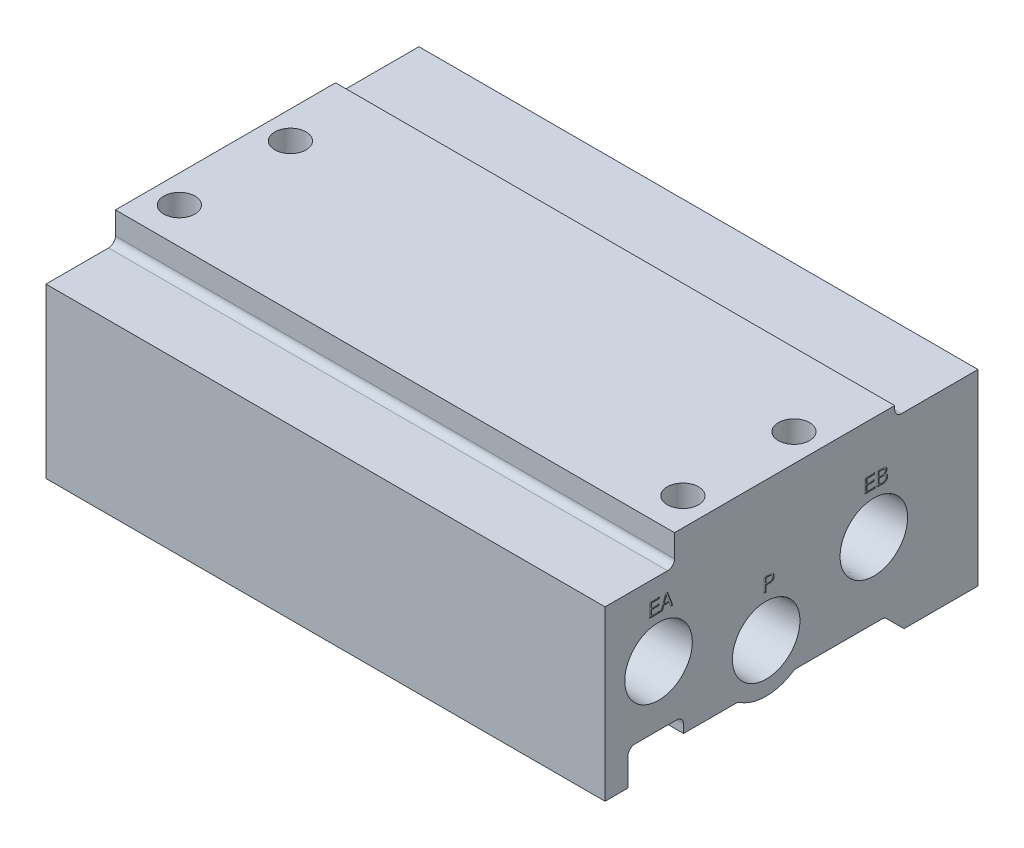
from build123d import *

# Parameters (mm, degrees)
ALUM_EXT_SKETCH_W          = 53.7
ALUM_EXT_SKETCH_H          = 28.5
ALUM_EXT_DEPTH             = 80.5
MGT_HOLES_SKETCH_R         = 2.25
MGT_HOLES_DEPTH            = 90.517721709
TOP_PROFILE_41_SKETCH_W    = 10
TOP_PROFILE_41_SKETCH_H    = 4.25
TOP_PROFILE_41_SKETCH_W_2  = 12
TOP_PROFILE_41_SKETCH_H_2  = 1.5
TOP_PROFILE_41_DEPTH       = 90.517721709
BOTTOM_PROFILE_41_DEPTH    = 90.517721709
ROUNDS_41_R                = 1
PORTS_AT_2_COUNT           = 2
PORTS_AT_2_PITCH           = 16.317475295
PORTS_AT_3_COUNT           = 2
PORTS_AT_3_PITCH           = 16.317475295
PORTS_MIRROR_AT_2_COUNT    = 2
PORTS_MIRROR_AT_2_PITCH    = 16.317475295
PORTS_MIRROR_AT_3_COUNT    = 2
PORTS_MIRROR_AT_3_PITCH    = 31
F_41_42_PORT_LABELS1_DEPTH = 0.1
F_41_42_PORT_LABELS2_DEPTH = 0.1
F_41_42_A_B_LABELS_DEPTH   = 0.1


with BuildPart() as part:
    # Alum Ext Sketch → Alum Ext (new body)
    with BuildSketch(Plane(origin=(0, 0, 0), x_dir=(0, 0, -1), z_dir=(1, 0, 0))):
        with Locations((0, -14.25)):
            Rectangle(ALUM_EXT_SKETCH_W, ALUM_EXT_SKETCH_H)
    extrude(amount=-ALUM_EXT_DEPTH)

    # MGT_Holes Sketch → MGT_Holes (cut, through all)
    with BuildSketch(Plane(origin=(0, 0, 0), x_dir=(1, 0, 0), z_dir=(0, 1, 0))):
        with Locations(Location((-76.5, 4.35, 0), (0, 0, 270))):
            Circle(MGT_HOLES_SKETCH_R)
        with Locations(Location((-76.5, -11.65, 0), (0, 0, 90))):
            Circle(MGT_HOLES_SKETCH_R)
        with Locations(Location((-4, 4.35, 0), (0, 0, 270))):
            Circle(MGT_HOLES_SKETCH_R)
        with Locations(Location((-4, -11.65, 0), (0, 0, 270))):
            Circle(MGT_HOLES_SKETCH_R)
    extrude(amount=-MGT_HOLES_DEPTH, mode=Mode.SUBTRACT)

    # Top_Profile_41 Sketch → Top_Profile_41 (cut, through all)
    with BuildSketch(Plane(origin=(0, 0, 0), x_dir=(0, 0, -1), z_dir=(1, 0, 0))):
        with Locations((-21.85, -2.125)):
            Rectangle(TOP_PROFILE_41_SKETCH_W, TOP_PROFILE_41_SKETCH_H)
        with Locations((20.85, -0.75)):
            Rectangle(TOP_PROFILE_41_SKETCH_W_2, TOP_PROFILE_41_SKETCH_H_2)
    extrude(amount=-TOP_PROFILE_41_DEPTH, mode=Mode.SUBTRACT)

    # Bottom_Profile_41 Sketch → Bottom_Profile_41 (cut, through all)
    with BuildSketch(Plane(origin=(0, 0, 0), x_dir=(0, 0, -1), z_dir=(1, 0, 0))):
        with BuildLine():
            Line((16.2, -28.5), (13.4, -25.7))
            Line((13.4, -25.7), (0.413249931, -25.7))
            ThreePointArc((0.413249931, -25.7), (-3.65, -27), (-7.713249931, -25.7))
            Line((-7.713249931, -25.7), (-15.55, -25.7))
            Line((-15.55, -25.7), (-15.55, -23.5))
            Line((-15.55, -23.5), (-23.55, -23.5))
            Line((-23.55, -23.5), (-23.55, -28.5))
            Line((-23.55, -28.5), (16.2, -28.5))
        make_face()
    extrude(amount=-BOTTOM_PROFILE_41_DEPTH, mode=Mode.SUBTRACT)

    # Rounds_41
    rounds_41_edges = [part.edges().sort_by_distance(p)[0] for p in [
        (-40.25, -4.25, 16.85),
        (-40.25, -1.5, -14.85),
        (-40.25, -25.7, -0.413249931),
        (-40.25, -23.5, 23.55),
        (-40.25, -23.5, 15.55),
        (-40.25, -25.7, 7.713249931),
        (-40.25, -25.7, -13.4),
    ]]
    fillet(rounds_41_edges, radius=ROUNDS_41_R)

    # Ports Profile Sketch → Ports (revolve, cut)
    with BuildSketch(Plane(origin=(0, -20, 3.65), x_dir=(0, 0, -1), z_dir=(0, 1, 0))):
        Polygon((0, 0), (0, 22.45), (3.95, 18.5), (3.95, 7.4), (4.632997004, 7.4), (4.864, 0), align=None)
    ports = revolve(axis=Axis((6.35, -20, 3.65), (-1, 0, 0)), mode=Mode.SUBTRACT)

    # Ports at 2: Ports ×2
    with Locations(*[Vector(0, 0.31254835125081226, -0.9499018518407041) * (i * PORTS_AT_2_PITCH) for i in range(1, PORTS_AT_2_COUNT)]):
        add(ports, mode=Mode.SUBTRACT)

    # Ports at 3: Ports ×2
    with Locations(*[Vector(0, 0.31254835125081226, 0.9499018518407041) * (i * PORTS_AT_3_PITCH) for i in range(1, PORTS_AT_3_COUNT)]):
        add(ports, mode=Mode.SUBTRACT)

    # Ports Mirror Profile Sketch → Ports Mirror (revolve, cut)
    with BuildSketch(Plane(origin=(-80.5, -14.9, -11.85), x_dir=(0, 0, 1), z_dir=(0, 1, 0))):
        Polygon((0, 0), (0, 15.885), (3.95, 11.935), (3.95, 7.4), (4.632997004, 7.4), (4.864, 0), align=None)
    ports_mirror = revolve(axis=Axis((-86.85, -14.9, -11.85), (1, 0, 0)), mode=Mode.SUBTRACT)

    # Ports Mirror at 2: Ports Mirror ×2
    with Locations(*[Vector(0, -0.31254835125081226, 0.9499018518407041) * (i * PORTS_MIRROR_AT_2_PITCH) for i in range(1, PORTS_MIRROR_AT_2_COUNT)]):
        add(ports_mirror, mode=Mode.SUBTRACT)

    # Ports Mirror at 3: Ports Mirror ×2
    with Locations(*[(0, 0, i * PORTS_MIRROR_AT_3_PITCH) for i in range(1, PORTS_MIRROR_AT_3_COUNT)]):
        add(ports_mirror, mode=Mode.SUBTRACT)

    # 41,42 Port Labels1 Sketch → 41,42 Port Labels1 (cut)
    # profile 1 of 5: a face of its own
    with BuildSketch(Plane.ZY.offset(80.5)):
        Polygon((-13.144871795, -8.9), (-13.144871795, -6.9), (-11.731410256, -6.9), (-11.731410256, -7.130769231), (-12.862820513, -7.130769231), (-12.862820513, -7.746153846), (-11.817948718, -7.746153846), (-11.817948718, -7.976923077), (-12.862820513, -7.976923077), (-12.862820513, -8.669230769), (-11.708974359, -8.669230769), (-11.708974359, -8.9), align=None)
    # profile 2 of 5: a face of its own
    with BuildSketch(Plane.ZY.offset(80.5)):
        with BuildLine():
            Line((-11.375641026, -8.9), (-11.375641026, -6.9))
            Line((-11.375641026, -6.9), (-10.582371795, -6.9))
            add(Edge.make_bspline(
                [(-10.582371795, -6.9), (-10.557520601, -6.900391088), (-10.509221677, -6.901151178), (-10.439257463, -6.906808568), (-10.373884128, -6.915794729), (-10.313491954, -6.928977632), (-10.25772712, -6.945607443), (-10.206981233, -6.966644139), (-10.160714162, -6.990826937), (-10.119486132, -7.019131964), (-10.082912178, -7.050918934), (-10.051607199, -7.087006382), (-10.024425363, -7.126312863), (-10.002795087, -7.169699096), (-9.985826511, -7.216613207), (-9.974014126, -7.267309873), (-9.966656438, -7.321659157), (-9.965816477, -7.359110147), (-9.965384615, -7.378365385)],
                knots=[0, 0, 0, 0, 1.338531614, 2.601470082, 3.778553788, 4.890456792, 5.928162005, 6.908738963, 7.84520586, 8.735147048, 9.596633689, 10.447968487, 11.301973765, 12.164180963, 13.051676454, 13.983434255, 14.963192844, 16, 16, 16, 16], degree=3))
            add(Edge.make_bspline(
                [(-9.965384615, -7.378365385), (-9.966331591, -7.402996395), (-9.968168925, -7.450785796), (-9.981718133, -7.519887959), (-10.005663085, -7.582918484), (-10.038410282, -7.640323126), (-10.080645807, -7.691469707), (-10.132507487, -7.735784439), (-10.193110711, -7.77443215), (-10.238424067, -7.793555438), (-10.261858974, -7.803445513)],
                knots=[0, 0, 0, 0, 1.064089938, 2.064560856, 3.027045975, 3.965441717, 4.908263127, 5.877849772, 6.902478258, 8, 8, 8, 8], degree=3))
            add(Edge.make_bspline(
                [(-10.261858974, -7.803445513), (-10.246569522, -7.806518626), (-10.216485798, -7.812565323), (-10.17316555, -7.826052918), (-10.132251748, -7.841956303), (-10.093880076, -7.860736947), (-10.058519403, -7.883036867), (-10.02554128, -7.907811801), (-9.995201163, -7.935720854), (-9.967752142, -7.966578157), (-9.94267115, -7.999705375), (-9.921668464, -8.035541546), (-9.903328698, -8.073092565), (-9.888526343, -8.112963113), (-9.876994446, -8.155075497), (-9.868507088, -8.199259529), (-9.863726514, -8.245513022), (-9.863126284, -8.276992465), (-9.862820513, -8.293028846)],
                knots=[0, 0, 0, 0, 1.079472139, 2.123983387, 3.137357801, 4.117691995, 5.07752268, 6.028353704, 6.970961659, 7.927265266, 8.885490285, 9.843581377, 10.799169054, 11.776706782, 12.784239396, 13.820032524, 14.889472473, 16, 16, 16, 16], degree=3))
            add(Edge.make_bspline(
                [(-9.862820513, -8.293028846), (-9.863272496, -8.315767522), (-9.864153514, -8.360090374), (-9.873541022, -8.424660596), (-9.887061044, -8.485768657), (-9.907353971, -8.543283868), (-9.933566292, -8.597000116), (-9.964872333, -8.647657469), (-10.002489133, -8.694254066), (-10.045355165, -8.737068494), (-10.093055612, -8.775646479), (-10.145401463, -8.808971319), (-10.201906819, -8.836986969), (-10.262136906, -8.860475813), (-10.326816833, -8.877901069), (-10.395416655, -8.890532564), (-10.468116052, -8.898929064), (-10.517977934, -8.899637332), (-10.543509615, -8.9)],
                knots=[0, 0, 0, 0, 1.058427598, 2.063116183, 3.033417234, 3.969927738, 4.896405358, 5.812972495, 6.737861532, 7.679194237, 8.630321786, 9.589794139, 10.563499171, 11.563941868, 12.596215416, 13.678433312, 14.811246201, 16, 16, 16, 16], degree=3))
            Line((-10.543509615, -8.9), (-11.375641026, -8.9))
        make_face()
        with BuildLine():
            Line((-11.093589744, -7.720512821), (-10.638060897, -7.720512821))
            add(Edge.make_bspline(
                [(-10.638060897, -7.720512821), (-10.62189856, -7.72024581), (-10.59060934, -7.719728896), (-10.545208349, -7.716795414), (-10.503095771, -7.710636868), (-10.464283505, -7.702711026), (-10.428663129, -7.693061693), (-10.39684222, -7.679824467), (-10.367793522, -7.665385266), (-10.342235553, -7.64779035), (-10.319629027, -7.628173795), (-10.300015633, -7.605914124), (-10.284162537, -7.580643527), (-10.270210543, -7.55333256), (-10.259923231, -7.523089629), (-10.252860224, -7.490409561), (-10.248348588, -7.45527911), (-10.247747178, -7.430997327), (-10.247435897, -7.418429487)],
                knots=[0, 0, 0, 0, 1.368886017, 2.65007316, 3.849640785, 4.969751217, 6.004381673, 6.968357812, 7.883879336, 8.746530739, 9.588092002, 10.41369514, 11.248159001, 12.107988605, 13.005734059, 13.944160956, 14.935932503, 16, 16, 16, 16], degree=3))
            add(Edge.make_bspline(
                [(-10.247435897, -7.418429487), (-10.24779526, -7.406534873), (-10.248487838, -7.383611119), (-10.252344592, -7.350275069), (-10.259615487, -7.319417291), (-10.2694704, -7.29082689), (-10.28256798, -7.264808482), (-10.298163447, -7.241021057), (-10.316774453, -7.219617856), (-10.338193209, -7.200634591), (-10.362634513, -7.184106045), (-10.389977449, -7.169577213), (-10.420615726, -7.157824898), (-10.454032304, -7.147613488), (-10.490564803, -7.140314754), (-10.529999659, -7.134572338), (-10.572575304, -7.131523238), (-10.60199904, -7.131026383), (-10.617227564, -7.130769231)],
                knots=[0, 0, 0, 0, 1.064043854, 2.05066597, 2.995108535, 3.894129092, 4.74873584, 5.593437176, 6.431611697, 7.277662936, 8.145602371, 9.064553025, 10.040417484, 11.075719197, 12.186014413, 13.368359838, 14.637970495, 16, 16, 16, 16], degree=3))
            Line((-10.617227564, -7.130769231), (-11.093589744, -7.130769231))
            Line((-11.093589744, -7.130769231), (-11.093589744, -7.720512821))
        make_face(mode=Mode.SUBTRACT)
        with BuildLine():
            Line((-11.093589744, -8.669230769), (-10.566746795, -8.669230769))
            add(Edge.make_bspline(
                [(-10.566746795, -8.669230769), (-10.549908372, -8.668922161), (-10.517373227, -8.668325869), (-10.470137599, -8.663774034), (-10.425994956, -8.656854934), (-10.385013028, -8.64634983), (-10.346971081, -8.633180858), (-10.312127837, -8.616877954), (-10.280547117, -8.597345386), (-10.251784041, -8.575352814), (-10.226609275, -8.550046268), (-10.204679995, -8.522071895), (-10.186188284, -8.49137213), (-10.170917321, -8.458069746), (-10.159316799, -8.421991925), (-10.151012013, -8.383343954), (-10.145625468, -8.342058175), (-10.145127121, -8.313612472), (-10.144871795, -8.299038462)],
                knots=[0, 0, 0, 0, 1.261340787, 2.437158505, 3.552412744, 4.605618057, 5.602418951, 6.564726798, 7.481099983, 8.379712099, 9.271165627, 10.147841252, 11.036708081, 11.950072001, 12.886651798, 13.869902527, 14.90865543, 16, 16, 16, 16], degree=3))
            add(Edge.make_bspline(
                [(-10.144871795, -8.299038462), (-10.145117446, -8.284595974), (-10.145594563, -8.256544995), (-10.151054338, -8.215943132), (-10.159140342, -8.17810658), (-10.171288059, -8.143473319), (-10.18652651, -8.111724261), (-10.205588286, -8.083183638), (-10.227647172, -8.057184402), (-10.253710324, -8.034583368), (-10.28331899, -8.01494812), (-10.31638283, -7.997503895), (-10.353598, -7.98333953), (-10.394496601, -7.971081379), (-10.439692519, -7.962804431), (-10.488439021, -7.955798704), (-10.541174333, -7.951838231), (-10.577557944, -7.951471772), (-10.596394231, -7.951282051)],
                knots=[0, 0, 0, 0, 1.058252033, 2.055394168, 2.998523969, 3.890395008, 4.739981298, 5.573732922, 6.40003374, 7.23274972, 8.093659094, 9.000297479, 9.967667442, 11.00874663, 12.12639854, 13.332554366, 14.619027337, 16, 16, 16, 16], degree=3))
            Line((-10.596394231, -7.951282051), (-11.093589744, -7.951282051))
            Line((-11.093589744, -7.951282051), (-11.093589744, -8.669230769))
        make_face(mode=Mode.SUBTRACT)
    # profile 3 of 5: a face of its own
    with BuildSketch(Plane.ZY.offset(80.5)):
        with BuildLine():
            Line((3.355128205, -14), (3.355128205, -12))
            Line((3.355128205, -12), (4.095913462, -12))
            add(Edge.make_bspline(
                [(4.095913462, -12), (4.12409362, -12.000249378), (4.177002091, -12.000717587), (4.250934098, -12.003608091), (4.314154858, -12.009200397), (4.368073681, -12.016451865), (4.415166702, -12.02754219), (4.458606554, -12.040013914), (4.499344903, -12.056098279), (4.524832794, -12.069234093), (4.537419872, -12.075721154)],
                knots=[0, 0, 0, 0, 1.493455121, 2.803973871, 3.919514338, 4.856337602, 5.683863995, 6.481055044, 7.249876038, 8, 8, 8, 8], degree=3))
            add(Edge.make_bspline(
                [(4.537419872, -12.075721154), (4.557109161, -12.087505308), (4.596238242, -12.110924292), (4.646867088, -12.157428597), (4.691435381, -12.210646113), (4.726929673, -12.2725773), (4.756116688, -12.340350372), (4.776198097, -12.414407034), (4.789029685, -12.493809121), (4.790347685, -12.548692188), (4.791025641, -12.576923077)],
                knots=[0, 0, 0, 0, 0.930560885, 1.849329941, 2.778623248, 3.742228717, 4.739438803, 5.770715934, 6.853295292, 8, 8, 8, 8], degree=3))
            add(Edge.make_bspline(
                [(4.791025641, -12.576923077), (4.790347059, -12.603953612), (4.78902587, -12.65658169), (4.776100386, -12.733053307), (4.755916476, -12.804708226), (4.727367087, -12.871331941), (4.690898401, -12.932063622), (4.64652939, -12.986531524), (4.594678687, -13.034755885), (4.555051994, -13.060899771), (4.535016026, -13.07411859)],
                knots=[0, 0, 0, 0, 1.106237948, 2.15382993, 3.166616047, 4.14912887, 5.113446575, 6.058253874, 7.018218259, 8, 8, 8, 8], degree=3))
            add(Edge.make_bspline(
                [(4.535016026, -13.07411859), (4.522597077, -13.081071894), (4.497311506, -13.095229151), (4.456117103, -13.111618603), (4.412179284, -13.125952788), (4.372704814, -13.134789239), (4.337996409, -13.140616309), (4.307779075, -13.144194947), (4.273668896, -13.146691653), (4.235640761, -13.149761537), (4.193551564, -13.151643471), (4.147467197, -13.152726574), (4.097518693, -13.153554018), (4.06292769, -13.153746548), (4.045032051, -13.153846154)],
                knots=[0, 0, 0, 0, 1.018466528, 2.073646265, 3.168741587, 4.32666575, 4.966710573, 5.68928523, 6.505122404, 7.416327688, 8.421864515, 9.522294478, 10.718160255, 12, 12, 12, 12], degree=3))
            Line((4.045032051, -13.153846154), (3.637179487, -13.153846154))
            Line((3.637179487, -13.153846154), (3.637179487, -14))
            Line((3.637179487, -14), (3.355128205, -14))
        make_face()
        with BuildLine():
            Line((3.637179487, -12.923076923), (4.087900641, -12.923076923))
            add(Edge.make_bspline(
                [(4.087900641, -12.923076923), (4.106734424, -12.922848085), (4.142970313, -12.922407806), (4.195182234, -12.919020543), (4.2428652, -12.912380011), (4.286306282, -12.90452837), (4.324991337, -12.892914993), (4.359724875, -12.880257808), (4.389709515, -12.863882812), (4.415997913, -12.84536947), (4.43829063, -12.823331396), (4.457379289, -12.798065143), (4.473409826, -12.769311124), (4.486624477, -12.737183964), (4.496532941, -12.70151272), (4.503634352, -12.662491291), (4.508057153, -12.619891899), (4.508660905, -12.590288992), (4.508974359, -12.574919872)],
                knots=[0, 0, 0, 0, 1.418142734, 2.728483292, 3.935852239, 5.042182902, 6.047730313, 6.973980857, 7.819836916, 8.612371598, 9.387426252, 10.169752478, 10.989196503, 11.859387264, 12.779284547, 13.771317079, 14.842921177, 16, 16, 16, 16], degree=3))
            add(Edge.make_bspline(
                [(4.508974359, -12.574919872), (4.508621001, -12.560087188), (4.507941592, -12.531568007), (4.504041052, -12.490281163), (4.497103925, -12.452223938), (4.486320171, -12.417522781), (4.473955018, -12.385611284), (4.457636989, -12.357322195), (4.43872536, -12.332221086), (4.416721841, -12.31008833), (4.391039013, -12.291246478), (4.361972539, -12.274585285), (4.328843401, -12.261233914), (4.292121529, -12.249962633), (4.251491521, -12.241304691), (4.207065619, -12.234912843), (4.15873708, -12.23141909), (4.125299202, -12.230991373), (4.107932692, -12.230769231)],
                knots=[0, 0, 0, 0, 1.160442503, 2.231212519, 3.241398704, 4.180061104, 5.070566702, 5.91288362, 6.725721963, 7.523583634, 8.344772017, 9.210415603, 10.137847341, 11.13257169, 12.212527806, 13.384203378, 14.64144318, 16, 16, 16, 16], degree=3))
            Line((4.107932692, -12.230769231), (3.637179487, -12.230769231))
            Line((3.637179487, -12.230769231), (3.637179487, -12.923076923))
        make_face(mode=Mode.SUBTRACT)
    # profile 4 of 5: a face of its own
    with BuildSketch(Plane.ZY.offset(80.5)):
        Polygon((17.855128205, -8.9), (17.855128205, -6.9), (19.268589744, -6.9), (19.268589744, -7.130769231), (18.137179487, -7.130769231), (18.137179487, -7.746153846), (19.182051282, -7.746153846), (19.182051282, -7.976923077), (18.137179487, -7.976923077), (18.137179487, -8.669230769), (19.291025641, -8.669230769), (19.291025641, -8.9), align=None)
    # profile 5 of 5: a face of its own
    with BuildSketch(Plane.ZY.offset(80.5)):
        Polygon((19.419230769, -8.9), (20.149198718, -6.9), (20.447676282, -6.9), (21.188461538, -8.9), (20.895592949, -8.9), (20.68525641, -8.31025641), (19.902403846, -8.31025641), (19.690464744, -8.9), align=None)
        Polygon((19.986137821, -8.079487179), (20.605528846, -8.079487179), (20.297836538, -7.188862179), align=None, mode=Mode.SUBTRACT)
    extrude(amount=-F_41_42_PORT_LABELS1_DEPTH, mode=Mode.SUBTRACT)

    # 41,42 Port Labels2 Sketch → 41,42 Port Labels2 (cut)
    # profile 1 of 5: a face of its own
    with BuildSketch(Plane(origin=(0, 0, 0), x_dir=(0, 0, -1), z_dir=(1, 0, 0))):
        Polygon((-20.444871795, -8.9), (-20.444871795, -6.9), (-19.031410256, -6.9), (-19.031410256, -7.130769231), (-20.162820513, -7.130769231), (-20.162820513, -7.746153846), (-19.117948718, -7.746153846), (-19.117948718, -7.976923077), (-20.162820513, -7.976923077), (-20.162820513, -8.669230769), (-19.008974359, -8.669230769), (-19.008974359, -8.9), align=None)
    # profile 2 of 5: a face of its own
    with BuildSketch(Plane(origin=(0, 0, 0), x_dir=(0, 0, -1), z_dir=(1, 0, 0))):
        Polygon((-18.880769231, -8.9), (-18.150801282, -6.9), (-17.852323718, -6.9), (-17.111538462, -8.9), (-17.404407051, -8.9), (-17.61474359, -8.31025641), (-18.397596154, -8.31025641), (-18.609535256, -8.9), align=None)
        Polygon((-18.313862179, -8.079487179), (-17.694471154, -8.079487179), (-18.002163462, -7.188862179), align=None, mode=Mode.SUBTRACT)
    # profile 3 of 5: a face of its own
    with BuildSketch(Plane(origin=(0, 0, 0), x_dir=(0, 0, -1), z_dir=(1, 0, 0))):
        with BuildLine():
            Line((-3.944871795, -14), (-3.944871795, -12))
            Line((-3.944871795, -12), (-3.204086538, -12))
            add(Edge.make_bspline(
                [(-3.204086538, -12), (-3.17590638, -12.000249378), (-3.122997909, -12.000717587), (-3.049065902, -12.003608091), (-2.985845142, -12.009200397), (-2.931926319, -12.016451865), (-2.884833298, -12.02754219), (-2.841393446, -12.040013914), (-2.800655097, -12.056098279), (-2.775167206, -12.069234093), (-2.762580128, -12.075721154)],
                knots=[0, 0, 0, 0, 1.493455121, 2.803973871, 3.919514338, 4.856337602, 5.683863995, 6.481055044, 7.249876038, 8, 8, 8, 8], degree=3))
            add(Edge.make_bspline(
                [(-2.762580128, -12.075721154), (-2.742890839, -12.087505308), (-2.703761758, -12.110924292), (-2.653132912, -12.157428597), (-2.608564619, -12.210646113), (-2.573070327, -12.2725773), (-2.543883312, -12.340350372), (-2.523801903, -12.414407034), (-2.510970315, -12.493809121), (-2.509652315, -12.548692188), (-2.508974359, -12.576923077)],
                knots=[0, 0, 0, 0, 0.930560885, 1.849329941, 2.778623248, 3.742228717, 4.739438803, 5.770715934, 6.853295292, 8, 8, 8, 8], degree=3))
            add(Edge.make_bspline(
                [(-2.508974359, -12.576923077), (-2.509652941, -12.603953612), (-2.51097413, -12.65658169), (-2.523899614, -12.733053307), (-2.544083524, -12.804708226), (-2.572632913, -12.871331941), (-2.609101599, -12.932063622), (-2.65347061, -12.986531524), (-2.705321313, -13.034755885), (-2.744948006, -13.060899771), (-2.764983974, -13.07411859)],
                knots=[0, 0, 0, 0, 1.106237948, 2.15382993, 3.166616047, 4.14912887, 5.113446575, 6.058253874, 7.018218259, 8, 8, 8, 8], degree=3))
            add(Edge.make_bspline(
                [(-2.764983974, -13.07411859), (-2.777402923, -13.081071894), (-2.802688494, -13.095229151), (-2.843882897, -13.111618603), (-2.887820716, -13.125952788), (-2.927295186, -13.134789239), (-2.962003591, -13.140616309), (-2.992220925, -13.144194947), (-3.026331104, -13.146691653), (-3.064359239, -13.149761537), (-3.106448436, -13.151643471), (-3.152532803, -13.152726574), (-3.202481307, -13.153554018), (-3.23707231, -13.153746548), (-3.254967949, -13.153846154)],
                knots=[0, 0, 0, 0, 1.018466528, 2.073646265, 3.168741587, 4.32666575, 4.966710573, 5.68928523, 6.505122404, 7.416327688, 8.421864515, 9.522294478, 10.718160255, 12, 12, 12, 12], degree=3))
            Line((-3.254967949, -13.153846154), (-3.662820513, -13.153846154))
            Line((-3.662820513, -13.153846154), (-3.662820513, -14))
            Line((-3.662820513, -14), (-3.944871795, -14))
        make_face()
        with BuildLine():
            Line((-3.662820513, -12.923076923), (-3.212099359, -12.923076923))
            add(Edge.make_bspline(
                [(-3.212099359, -12.923076923), (-3.193265576, -12.922848085), (-3.157029687, -12.922407806), (-3.104817766, -12.919020543), (-3.0571348, -12.912380011), (-3.013693718, -12.90452837), (-2.975008663, -12.892914993), (-2.940275125, -12.880257808), (-2.910290485, -12.863882812), (-2.884002087, -12.84536947), (-2.86170937, -12.823331396), (-2.842620711, -12.798065143), (-2.826590174, -12.769311124), (-2.813375523, -12.737183964), (-2.803467059, -12.70151272), (-2.796365648, -12.662491291), (-2.791942847, -12.619891899), (-2.791339095, -12.590288992), (-2.791025641, -12.574919872)],
                knots=[0, 0, 0, 0, 1.418142734, 2.728483292, 3.935852239, 5.042182902, 6.047730313, 6.973980857, 7.819836916, 8.612371598, 9.387426252, 10.169752478, 10.989196503, 11.859387264, 12.779284547, 13.771317079, 14.842921177, 16, 16, 16, 16], degree=3))
            add(Edge.make_bspline(
                [(-2.791025641, -12.574919872), (-2.791378999, -12.560087188), (-2.792058408, -12.531568007), (-2.795958948, -12.490281163), (-2.802896075, -12.452223938), (-2.813679829, -12.417522781), (-2.826044982, -12.385611284), (-2.842363011, -12.357322195), (-2.86127464, -12.332221086), (-2.883278159, -12.31008833), (-2.908960987, -12.291246478), (-2.938027461, -12.274585285), (-2.971156599, -12.261233914), (-3.007878471, -12.249962633), (-3.048508479, -12.241304691), (-3.092934381, -12.234912843), (-3.14126292, -12.23141909), (-3.174700798, -12.230991373), (-3.192067308, -12.230769231)],
                knots=[0, 0, 0, 0, 1.160442503, 2.231212519, 3.241398704, 4.180061104, 5.070566702, 5.91288362, 6.725721963, 7.523583634, 8.344772017, 9.210415603, 10.137847341, 11.13257169, 12.212527806, 13.384203378, 14.64144318, 16, 16, 16, 16], degree=3))
            Line((-3.192067308, -12.230769231), (-3.662820513, -12.230769231))
            Line((-3.662820513, -12.230769231), (-3.662820513, -12.923076923))
        make_face(mode=Mode.SUBTRACT)
    # profile 4 of 5: a face of its own
    with BuildSketch(Plane(origin=(0, 0, 0), x_dir=(0, 0, -1), z_dir=(1, 0, 0))):
        Polygon((10.555128205, -8.9), (10.555128205, -6.9), (11.968589744, -6.9), (11.968589744, -7.130769231), (10.837179487, -7.130769231), (10.837179487, -7.746153846), (11.882051282, -7.746153846), (11.882051282, -7.976923077), (10.837179487, -7.976923077), (10.837179487, -8.669230769), (11.991025641, -8.669230769), (11.991025641, -8.9), align=None)
    # profile 5 of 5: a face of its own
    with BuildSketch(Plane(origin=(0, 0, 0), x_dir=(0, 0, -1), z_dir=(1, 0, 0))):
        with BuildLine():
            Line((12.324358974, -8.9), (12.324358974, -6.9))
            Line((12.324358974, -6.9), (13.117628205, -6.9))
            add(Edge.make_bspline(
                [(13.117628205, -6.9), (13.142479399, -6.900391088), (13.190778323, -6.901151178), (13.260742537, -6.906808568), (13.326115872, -6.915794729), (13.386508046, -6.928977632), (13.44227288, -6.945607443), (13.493018767, -6.966644139), (13.539285838, -6.990826937), (13.580513868, -7.019131964), (13.617087822, -7.050918934), (13.648392801, -7.087006382), (13.675574637, -7.126312863), (13.697204913, -7.169699096), (13.714173489, -7.216613207), (13.725985874, -7.267309873), (13.733343562, -7.321659157), (13.734183523, -7.359110147), (13.734615385, -7.378365385)],
                knots=[0, 0, 0, 0, 1.338531614, 2.601470082, 3.778553788, 4.890456792, 5.928162005, 6.908738963, 7.84520586, 8.735147048, 9.596633689, 10.447968487, 11.301973765, 12.164180963, 13.051676454, 13.983434255, 14.963192844, 16, 16, 16, 16], degree=3))
            add(Edge.make_bspline(
                [(13.734615385, -7.378365385), (13.733668409, -7.402996395), (13.731831075, -7.450785796), (13.718281867, -7.519887959), (13.694336915, -7.582918484), (13.661589718, -7.640323126), (13.619354193, -7.691469707), (13.567492513, -7.735784439), (13.506889289, -7.77443215), (13.461575933, -7.793555438), (13.438141026, -7.803445513)],
                knots=[0, 0, 0, 0, 1.064089938, 2.064560856, 3.027045975, 3.965441717, 4.908263127, 5.877849772, 6.902478258, 8, 8, 8, 8], degree=3))
            add(Edge.make_bspline(
                [(13.438141026, -7.803445513), (13.453430478, -7.806518626), (13.483514202, -7.812565323), (13.52683445, -7.826052918), (13.567748252, -7.841956303), (13.606119924, -7.860736947), (13.641480597, -7.883036867), (13.67445872, -7.907811801), (13.704798837, -7.935720854), (13.732247858, -7.966578157), (13.75732885, -7.999705375), (13.778331536, -8.035541546), (13.796671302, -8.073092565), (13.811473657, -8.112963113), (13.823005554, -8.155075497), (13.831492912, -8.199259529), (13.836273486, -8.245513022), (13.836873716, -8.276992465), (13.837179487, -8.293028846)],
                knots=[0, 0, 0, 0, 1.079472139, 2.123983387, 3.137357801, 4.117691995, 5.07752268, 6.028353704, 6.970961659, 7.927265266, 8.885490285, 9.843581377, 10.799169054, 11.776706782, 12.784239396, 13.820032524, 14.889472473, 16, 16, 16, 16], degree=3))
            add(Edge.make_bspline(
                [(13.837179487, -8.293028846), (13.836727504, -8.315767522), (13.835846486, -8.360090374), (13.826458978, -8.424660596), (13.812938956, -8.485768657), (13.792646029, -8.543283868), (13.766433708, -8.597000116), (13.735127667, -8.647657469), (13.697510867, -8.694254066), (13.654644835, -8.737068494), (13.606944388, -8.775646479), (13.554598537, -8.808971319), (13.498093181, -8.836986969), (13.437863094, -8.860475813), (13.373183167, -8.877901069), (13.304583345, -8.890532564), (13.231883948, -8.898929064), (13.182022066, -8.899637332), (13.156490385, -8.9)],
                knots=[0, 0, 0, 0, 1.058427598, 2.063116183, 3.033417234, 3.969927738, 4.896405358, 5.812972495, 6.737861532, 7.679194237, 8.630321786, 9.589794139, 10.563499171, 11.563941868, 12.596215416, 13.678433312, 14.811246201, 16, 16, 16, 16], degree=3))
            Line((13.156490385, -8.9), (12.324358974, -8.9))
        make_face()
        with BuildLine():
            Line((12.606410256, -7.720512821), (13.061939103, -7.720512821))
            add(Edge.make_bspline(
                [(13.061939103, -7.720512821), (13.07810144, -7.72024581), (13.10939066, -7.719728896), (13.154791651, -7.716795414), (13.196904229, -7.710636868), (13.235716495, -7.702711026), (13.271336871, -7.693061693), (13.30315778, -7.679824467), (13.332206478, -7.665385266), (13.357764447, -7.64779035), (13.380370973, -7.628173795), (13.399984367, -7.605914124), (13.415837463, -7.580643527), (13.429789457, -7.55333256), (13.440076769, -7.523089629), (13.447139776, -7.490409561), (13.451651412, -7.45527911), (13.452252822, -7.430997327), (13.452564103, -7.418429487)],
                knots=[0, 0, 0, 0, 1.368886017, 2.65007316, 3.849640785, 4.969751217, 6.004381673, 6.968357812, 7.883879336, 8.746530739, 9.588092002, 10.41369514, 11.248159001, 12.107988605, 13.005734059, 13.944160956, 14.935932503, 16, 16, 16, 16], degree=3))
            add(Edge.make_bspline(
                [(13.452564103, -7.418429487), (13.45220474, -7.406534873), (13.451512162, -7.383611119), (13.447655408, -7.350275069), (13.440384513, -7.319417291), (13.4305296, -7.29082689), (13.41743202, -7.264808482), (13.401836553, -7.241021057), (13.383225547, -7.219617856), (13.361806791, -7.200634591), (13.337365487, -7.184106045), (13.310022551, -7.169577213), (13.279384274, -7.157824898), (13.245967696, -7.147613488), (13.209435197, -7.140314754), (13.170000341, -7.134572338), (13.127424696, -7.131523238), (13.09800096, -7.131026383), (13.082772436, -7.130769231)],
                knots=[0, 0, 0, 0, 1.064043854, 2.05066597, 2.995108535, 3.894129092, 4.74873584, 5.593437176, 6.431611697, 7.277662936, 8.145602371, 9.064553025, 10.040417484, 11.075719197, 12.186014413, 13.368359838, 14.637970495, 16, 16, 16, 16], degree=3))
            Line((13.082772436, -7.130769231), (12.606410256, -7.130769231))
            Line((12.606410256, -7.130769231), (12.606410256, -7.720512821))
        make_face(mode=Mode.SUBTRACT)
        with BuildLine():
            Line((12.606410256, -8.669230769), (13.133253205, -8.669230769))
            add(Edge.make_bspline(
                [(13.133253205, -8.669230769), (13.150091628, -8.668922161), (13.182626773, -8.668325869), (13.229862401, -8.663774034), (13.274005044, -8.656854934), (13.314986972, -8.64634983), (13.353028919, -8.633180858), (13.387872163, -8.616877954), (13.419452883, -8.597345386), (13.448215959, -8.575352814), (13.473390725, -8.550046268), (13.495320005, -8.522071895), (13.513811716, -8.49137213), (13.529082679, -8.458069746), (13.540683201, -8.421991925), (13.548987987, -8.383343954), (13.554374532, -8.342058175), (13.554872879, -8.313612472), (13.555128205, -8.299038462)],
                knots=[0, 0, 0, 0, 1.261340787, 2.437158505, 3.552412744, 4.605618057, 5.602418951, 6.564726798, 7.481099983, 8.379712099, 9.271165627, 10.147841252, 11.036708081, 11.950072001, 12.886651798, 13.869902527, 14.90865543, 16, 16, 16, 16], degree=3))
            add(Edge.make_bspline(
                [(13.555128205, -8.299038462), (13.554882554, -8.284595974), (13.554405437, -8.256544995), (13.548945662, -8.215943132), (13.540859658, -8.17810658), (13.528711941, -8.143473319), (13.51347349, -8.111724261), (13.494411714, -8.083183638), (13.472352828, -8.057184402), (13.446289676, -8.034583368), (13.41668101, -8.01494812), (13.38361717, -7.997503895), (13.346402, -7.98333953), (13.305503399, -7.971081379), (13.260307481, -7.962804431), (13.211560979, -7.955798704), (13.158825667, -7.951838231), (13.122442056, -7.951471772), (13.103605769, -7.951282051)],
                knots=[0, 0, 0, 0, 1.058252033, 2.055394168, 2.998523969, 3.890395008, 4.739981298, 5.573732922, 6.40003374, 7.23274972, 8.093659094, 9.000297479, 9.967667442, 11.00874663, 12.12639854, 13.332554366, 14.619027337, 16, 16, 16, 16], degree=3))
            Line((13.103605769, -7.951282051), (12.606410256, -7.951282051))
            Line((12.606410256, -7.951282051), (12.606410256, -8.669230769))
        make_face(mode=Mode.SUBTRACT)
    extrude(amount=-F_41_42_PORT_LABELS2_DEPTH, mode=Mode.SUBTRACT)

    # 41,42 A,B Labels Sketch → 41,42 A,B Labels (cut)
    # profile 1 of 4: a face of its own
    with BuildSketch(Plane.XY.offset(-26.85)):
        Polygon((-76, -10), (-77.27744391, -6.5), (-77.799779647, -6.5), (-79.096153846, -10), (-78.583633814, -10), (-78.215544872, -8.967948718), (-76.845552885, -8.967948718), (-76.474659455, -10), align=None)
        Polygon((-76.99208734, -8.564102564), (-78.076021635, -8.564102564), (-77.537560096, -7.005508814), align=None, mode=Mode.SUBTRACT)
    # profile 2 of 4: a face of its own
    with BuildSketch(Plane.XY.offset(-26.85)):
        with BuildLine():
            Line((-69.858974359, -23.5), (-69.858974359, -20))
            Line((-69.858974359, -20), (-71.247195513, -20))
            add(Edge.make_bspline(
                [(-71.247195513, -20), (-71.290685102, -20.000684404), (-71.375208219, -20.002014561), (-71.497645593, -20.011914994), (-71.61204893, -20.027640776), (-71.717735234, -20.050710856), (-71.815323694, -20.079813026), (-71.904128997, -20.116627242), (-71.985096371, -20.158947141), (-72.057245422, -20.208480936), (-72.121249843, -20.264108134), (-72.176033556, -20.327261168), (-72.223601769, -20.396047509), (-72.261454752, -20.471973419), (-72.29114976, -20.554073113), (-72.311821433, -20.642792277), (-72.324697388, -20.737903525), (-72.326167319, -20.803442756), (-72.326923077, -20.837139423)],
                knots=[0, 0, 0, 0, 1.338531614, 2.601470082, 3.778553788, 4.890456792, 5.928162005, 6.908738963, 7.84520586, 8.735147048, 9.596633689, 10.447968487, 11.301973765, 12.164180963, 13.051676454, 13.983434255, 14.963192844, 16, 16, 16, 16], degree=3))
            add(Edge.make_bspline(
                [(-72.326923077, -20.837139423), (-72.32526587, -20.880243692), (-72.322050535, -20.963875144), (-72.29833942, -21.084803928), (-72.256435755, -21.195107347), (-72.199128161, -21.295565471), (-72.125215992, -21.385071987), (-72.034458052, -21.462622768), (-71.928402409, -21.530256263), (-71.849104036, -21.563722017), (-71.808092949, -21.581029647)],
                knots=[0, 0, 0, 0, 1.064089938, 2.064560856, 3.027045975, 3.965441717, 4.908263127, 5.877849772, 6.902478258, 8, 8, 8, 8], degree=3))
            add(Edge.make_bspline(
                [(-71.808092949, -21.581029647), (-71.83484949, -21.586407596), (-71.887496008, -21.596989316), (-71.963306442, -21.620592607), (-72.034905595, -21.648423531), (-72.102056021, -21.681289657), (-72.163937199, -21.720314518), (-72.221648914, -21.763670652), (-72.274744119, -21.812511494), (-72.322779905, -21.866511775), (-72.366671641, -21.924484406), (-72.403426342, -21.987197706), (-72.435520932, -22.052911989), (-72.461425053, -22.122685447), (-72.481605873, -22.196382119), (-72.49645875, -22.273704176), (-72.504824755, -22.354647789), (-72.505875157, -22.409736815), (-72.506410256, -22.437800481)],
                knots=[0, 0, 0, 0, 1.079472139, 2.123983387, 3.137357801, 4.117691995, 5.07752268, 6.028353704, 6.970961659, 7.927265266, 8.885490285, 9.843581377, 10.799169054, 11.776706782, 12.784239396, 13.820032524, 14.889472473, 16, 16, 16, 16], degree=3))
            add(Edge.make_bspline(
                [(-72.506410256, -22.437800481), (-72.505619286, -22.477593164), (-72.504077505, -22.555158155), (-72.487649365, -22.668156042), (-72.463989327, -22.77509515), (-72.428476704, -22.875746769), (-72.382605143, -22.969750203), (-72.327819571, -23.058400571), (-72.261990171, -23.139944616), (-72.186974614, -23.214869865), (-72.103498834, -23.282381338), (-72.011893594, -23.340699808), (-71.91300922, -23.389727196), (-71.807606568, -23.430832673), (-71.694416695, -23.461326871), (-71.574367008, -23.483431987), (-71.447143063, -23.498125862), (-71.35988477, -23.499365332), (-71.315204327, -23.5)],
                knots=[0, 0, 0, 0, 1.058427598, 2.063116183, 3.033417234, 3.969927738, 4.896405358, 5.812972495, 6.737861532, 7.679194237, 8.630321786, 9.589794139, 10.563499171, 11.563941868, 12.596215416, 13.678433312, 14.811246201, 16, 16, 16, 16], degree=3))
            Line((-71.315204327, -23.5), (-69.858974359, -23.5))
        make_face()
        with BuildLine():
            Line((-70.352564103, -21.435897436), (-71.149739583, -21.435897436))
            add(Edge.make_bspline(
                [(-71.149739583, -21.435897436), (-71.178023674, -21.435430168), (-71.23277981, -21.434525568), (-71.312231542, -21.429391974), (-71.385928555, -21.418614519), (-71.453850021, -21.404744295), (-71.516185678, -21.387857963), (-71.571872268, -21.364692817), (-71.62270749, -21.339424215), (-71.667433937, -21.308633112), (-71.706995357, -21.274304141), (-71.741318795, -21.235349716), (-71.769061713, -21.191126172), (-71.793477703, -21.143331981), (-71.8114805, -21.09040685), (-71.823840762, -21.033216732), (-71.831736124, -20.971738443), (-71.832788593, -20.929245323), (-71.833333333, -20.907251603)],
                knots=[0, 0, 0, 0, 1.368886017, 2.65007316, 3.849640785, 4.969751217, 6.004381673, 6.968357812, 7.883879336, 8.746530739, 9.588092002, 10.41369514, 11.248159001, 12.107988605, 13.005734059, 13.944160956, 14.935932503, 16, 16, 16, 16], degree=3))
            add(Edge.make_bspline(
                [(-71.833333333, -20.907251603), (-71.832704448, -20.886436029), (-71.831492437, -20.846319459), (-71.824743118, -20.78798137), (-71.812019051, -20.733980259), (-71.794772954, -20.683947058), (-71.771852189, -20.638414843), (-71.744560122, -20.59678685), (-71.711990861, -20.559331249), (-71.674508037, -20.526110534), (-71.631735756, -20.497185578), (-71.583885618, -20.471760122), (-71.530268633, -20.451193571), (-71.471789621, -20.433323604), (-71.407857749, -20.42055082), (-71.33884675, -20.410501592), (-71.264339373, -20.405165666), (-71.212847835, -20.40429617), (-71.186197917, -20.403846154)],
                knots=[0, 0, 0, 0, 1.064043854, 2.05066597, 2.995108535, 3.894129092, 4.74873584, 5.593437176, 6.431611697, 7.277662936, 8.145602371, 9.064553025, 10.040417484, 11.075719197, 12.186014413, 13.368359838, 14.637970495, 16, 16, 16, 16], degree=3))
            Line((-71.186197917, -20.403846154), (-70.352564103, -20.403846154))
            Line((-70.352564103, -20.403846154), (-70.352564103, -21.435897436))
        make_face(mode=Mode.SUBTRACT)
        with BuildLine():
            Line((-70.352564103, -23.096153846), (-71.274539263, -23.096153846))
            add(Edge.make_bspline(
                [(-71.274539263, -23.096153846), (-71.304006503, -23.095613782), (-71.360943007, -23.094570271), (-71.443605356, -23.086604559), (-71.520854981, -23.074496135), (-71.592573355, -23.056112202), (-71.659146761, -23.033066501), (-71.720122439, -23.004536419), (-71.775388699, -22.970354426), (-71.825724082, -22.931867424), (-71.869779923, -22.88758097), (-71.908156162, -22.838625817), (-71.940516657, -22.784901228), (-71.967240842, -22.726622055), (-71.987541756, -22.663485868), (-72.002075131, -22.595851919), (-72.011501585, -22.523601806), (-72.012373693, -22.473821826), (-72.012820513, -22.448317308)],
                knots=[0, 0, 0, 0, 1.261340787, 2.437158505, 3.552412744, 4.605618057, 5.602418951, 6.564726798, 7.481099983, 8.379712099, 9.271165627, 10.147841252, 11.036708081, 11.950072001, 12.886651798, 13.869902527, 14.90865543, 16, 16, 16, 16], degree=3))
            add(Edge.make_bspline(
                [(-72.012820513, -22.448317308), (-72.012390624, -22.423042954), (-72.011555669, -22.373953741), (-72.002001063, -22.30290048), (-71.987850556, -22.236686515), (-71.966592051, -22.176078308), (-71.939924762, -22.120517457), (-71.906566653, -22.070571367), (-71.867963603, -22.025072704), (-71.822353087, -21.985520894), (-71.770537921, -21.95115921), (-71.712676202, -21.920631816), (-71.647549654, -21.895844178), (-71.575977103, -21.874392413), (-71.496884246, -21.859907754), (-71.411577868, -21.847647732), (-71.319291071, -21.840716904), (-71.255619752, -21.840075601), (-71.22265625, -21.83974359)],
                knots=[0, 0, 0, 0, 1.058252033, 2.055394168, 2.998523969, 3.890395008, 4.739981298, 5.573732922, 6.40003374, 7.23274972, 8.093659094, 9.000297479, 9.967667442, 11.00874663, 12.12639854, 13.332554366, 14.619027337, 16, 16, 16, 16], degree=3))
            Line((-71.22265625, -21.83974359), (-70.352564103, -21.83974359))
            Line((-70.352564103, -21.83974359), (-70.352564103, -23.096153846))
        make_face(mode=Mode.SUBTRACT)
    # profile 3 of 4: a face of its own
    with BuildSketch(Plane.XY.offset(-26.85)):
        Polygon((-8, -10), (-9.27744391, -6.5), (-9.799779647, -6.5), (-11.096153846, -10), (-10.583633814, -10), (-10.215544872, -8.967948718), (-8.845552885, -8.967948718), (-8.474659455, -10), align=None)
        Polygon((-8.99208734, -8.564102564), (-10.076021635, -8.564102564), (-9.537560096, -7.005508814), align=None, mode=Mode.SUBTRACT)
    # profile 4 of 4: a face of its own
    with BuildSketch(Plane.XY.offset(-26.85)):
        with BuildLine():
            Line((-1.358974359, -23.5), (-1.358974359, -20))
            Line((-1.358974359, -20), (-2.747195513, -20))
            add(Edge.make_bspline(
                [(-2.747195513, -20), (-2.790685102, -20.000684404), (-2.875208219, -20.002014561), (-2.997645593, -20.011914994), (-3.11204893, -20.027640776), (-3.217735234, -20.050710856), (-3.315323694, -20.079813026), (-3.404128997, -20.116627242), (-3.485096371, -20.158947141), (-3.557245422, -20.208480936), (-3.621249843, -20.264108134), (-3.676033556, -20.327261168), (-3.723601769, -20.396047509), (-3.761454752, -20.471973419), (-3.79114976, -20.554073113), (-3.811821433, -20.642792277), (-3.824697388, -20.737903525), (-3.826167319, -20.803442756), (-3.826923077, -20.837139423)],
                knots=[0, 0, 0, 0, 1.338531614, 2.601470082, 3.778553788, 4.890456792, 5.928162005, 6.908738963, 7.84520586, 8.735147048, 9.596633689, 10.447968487, 11.301973765, 12.164180963, 13.051676454, 13.983434255, 14.963192844, 16, 16, 16, 16], degree=3))
            add(Edge.make_bspline(
                [(-3.826923077, -20.837139423), (-3.82526587, -20.880243692), (-3.822050535, -20.963875144), (-3.79833942, -21.084803928), (-3.756435755, -21.195107347), (-3.699128161, -21.295565471), (-3.625215992, -21.385071987), (-3.534458052, -21.462622768), (-3.428402409, -21.530256263), (-3.349104036, -21.563722017), (-3.308092949, -21.581029647)],
                knots=[0, 0, 0, 0, 1.064089938, 2.064560856, 3.027045975, 3.965441717, 4.908263127, 5.877849772, 6.902478258, 8, 8, 8, 8], degree=3))
            add(Edge.make_bspline(
                [(-3.308092949, -21.581029647), (-3.33484949, -21.586407596), (-3.387496008, -21.596989316), (-3.463306442, -21.620592607), (-3.534905595, -21.648423531), (-3.602056021, -21.681289657), (-3.663937199, -21.720314518), (-3.721648914, -21.763670652), (-3.774744119, -21.812511494), (-3.822779905, -21.866511775), (-3.866671641, -21.924484406), (-3.903426342, -21.987197706), (-3.935520932, -22.052911989), (-3.961425053, -22.122685447), (-3.981605873, -22.196382119), (-3.99645875, -22.273704176), (-4.004824755, -22.354647789), (-4.005875157, -22.409736815), (-4.006410256, -22.437800481)],
                knots=[0, 0, 0, 0, 1.079472139, 2.123983387, 3.137357801, 4.117691995, 5.07752268, 6.028353704, 6.970961659, 7.927265266, 8.885490285, 9.843581377, 10.799169054, 11.776706782, 12.784239396, 13.820032524, 14.889472473, 16, 16, 16, 16], degree=3))
            add(Edge.make_bspline(
                [(-4.006410256, -22.437800481), (-4.005619286, -22.477593164), (-4.004077505, -22.555158155), (-3.987649365, -22.668156042), (-3.963989327, -22.77509515), (-3.928476704, -22.875746769), (-3.882605143, -22.969750203), (-3.827819571, -23.058400571), (-3.761990171, -23.139944616), (-3.686974614, -23.214869865), (-3.603498834, -23.282381338), (-3.511893594, -23.340699808), (-3.41300922, -23.389727196), (-3.307606568, -23.430832673), (-3.194416695, -23.461326871), (-3.074367008, -23.483431987), (-2.947143063, -23.498125862), (-2.85988477, -23.499365332), (-2.815204327, -23.5)],
                knots=[0, 0, 0, 0, 1.058427598, 2.063116183, 3.033417234, 3.969927738, 4.896405358, 5.812972495, 6.737861532, 7.679194237, 8.630321786, 9.589794139, 10.563499171, 11.563941868, 12.596215416, 13.678433312, 14.811246201, 16, 16, 16, 16], degree=3))
            Line((-2.815204327, -23.5), (-1.358974359, -23.5))
        make_face()
        with BuildLine():
            Line((-1.852564103, -21.435897436), (-2.649739583, -21.435897436))
            add(Edge.make_bspline(
                [(-2.649739583, -21.435897436), (-2.678023674, -21.435430168), (-2.73277981, -21.434525568), (-2.812231542, -21.429391974), (-2.885928555, -21.418614519), (-2.953850021, -21.404744295), (-3.016185678, -21.387857963), (-3.071872268, -21.364692817), (-3.12270749, -21.339424215), (-3.167433937, -21.308633112), (-3.206995357, -21.274304141), (-3.241318795, -21.235349716), (-3.269061713, -21.191126172), (-3.293477703, -21.143331981), (-3.3114805, -21.09040685), (-3.323840762, -21.033216732), (-3.331736124, -20.971738443), (-3.332788593, -20.929245323), (-3.333333333, -20.907251603)],
                knots=[0, 0, 0, 0, 1.368886017, 2.65007316, 3.849640785, 4.969751217, 6.004381673, 6.968357812, 7.883879336, 8.746530739, 9.588092002, 10.41369514, 11.248159001, 12.107988605, 13.005734059, 13.944160956, 14.935932503, 16, 16, 16, 16], degree=3))
            add(Edge.make_bspline(
                [(-3.333333333, -20.907251603), (-3.332704448, -20.886436029), (-3.331492437, -20.846319459), (-3.324743118, -20.78798137), (-3.312019051, -20.733980259), (-3.294772954, -20.683947058), (-3.271852189, -20.638414843), (-3.244560122, -20.59678685), (-3.211990861, -20.559331249), (-3.174508037, -20.526110534), (-3.131735756, -20.497185578), (-3.083885618, -20.471760122), (-3.030268633, -20.451193571), (-2.971789621, -20.433323604), (-2.907857749, -20.42055082), (-2.83884675, -20.410501592), (-2.764339373, -20.405165666), (-2.712847835, -20.40429617), (-2.686197917, -20.403846154)],
                knots=[0, 0, 0, 0, 1.064043854, 2.05066597, 2.995108535, 3.894129092, 4.74873584, 5.593437176, 6.431611697, 7.277662936, 8.145602371, 9.064553025, 10.040417484, 11.075719197, 12.186014413, 13.368359838, 14.637970495, 16, 16, 16, 16], degree=3))
            Line((-2.686197917, -20.403846154), (-1.852564103, -20.403846154))
            Line((-1.852564103, -20.403846154), (-1.852564103, -21.435897436))
        make_face(mode=Mode.SUBTRACT)
        with BuildLine():
            Line((-1.852564103, -23.096153846), (-2.774539263, -23.096153846))
            add(Edge.make_bspline(
                [(-2.774539263, -23.096153846), (-2.804006503, -23.095613782), (-2.860943007, -23.094570271), (-2.943605356, -23.086604559), (-3.020854981, -23.074496135), (-3.092573355, -23.056112202), (-3.159146761, -23.033066501), (-3.220122439, -23.004536419), (-3.275388699, -22.970354426), (-3.325724082, -22.931867424), (-3.369779923, -22.88758097), (-3.408156162, -22.838625817), (-3.440516657, -22.784901228), (-3.467240842, -22.726622055), (-3.487541756, -22.663485868), (-3.502075131, -22.595851919), (-3.511501585, -22.523601806), (-3.512373693, -22.473821826), (-3.512820513, -22.448317308)],
                knots=[0, 0, 0, 0, 1.261340787, 2.437158505, 3.552412744, 4.605618057, 5.602418951, 6.564726798, 7.481099983, 8.379712099, 9.271165627, 10.147841252, 11.036708081, 11.950072001, 12.886651798, 13.869902527, 14.90865543, 16, 16, 16, 16], degree=3))
            add(Edge.make_bspline(
                [(-3.512820513, -22.448317308), (-3.512390624, -22.423042954), (-3.511555669, -22.373953741), (-3.502001063, -22.30290048), (-3.487850556, -22.236686515), (-3.466592051, -22.176078308), (-3.439924762, -22.120517457), (-3.406566653, -22.070571367), (-3.367963603, -22.025072704), (-3.322353087, -21.985520894), (-3.270537921, -21.95115921), (-3.212676202, -21.920631816), (-3.147549654, -21.895844178), (-3.075977103, -21.874392413), (-2.996884246, -21.859907754), (-2.911577868, -21.847647732), (-2.819291071, -21.840716904), (-2.755619752, -21.840075601), (-2.72265625, -21.83974359)],
                knots=[0, 0, 0, 0, 1.058252033, 2.055394168, 2.998523969, 3.890395008, 4.739981298, 5.573732922, 6.40003374, 7.23274972, 8.093659094, 9.000297479, 9.967667442, 11.00874663, 12.12639854, 13.332554366, 14.619027337, 16, 16, 16, 16], degree=3))
            Line((-2.72265625, -21.83974359), (-1.852564103, -21.83974359))
            Line((-1.852564103, -21.83974359), (-1.852564103, -23.096153846))
        make_face(mode=Mode.SUBTRACT)
    extrude(amount=F_41_42_A_B_LABELS_DEPTH, mode=Mode.SUBTRACT)


solid = part.part
